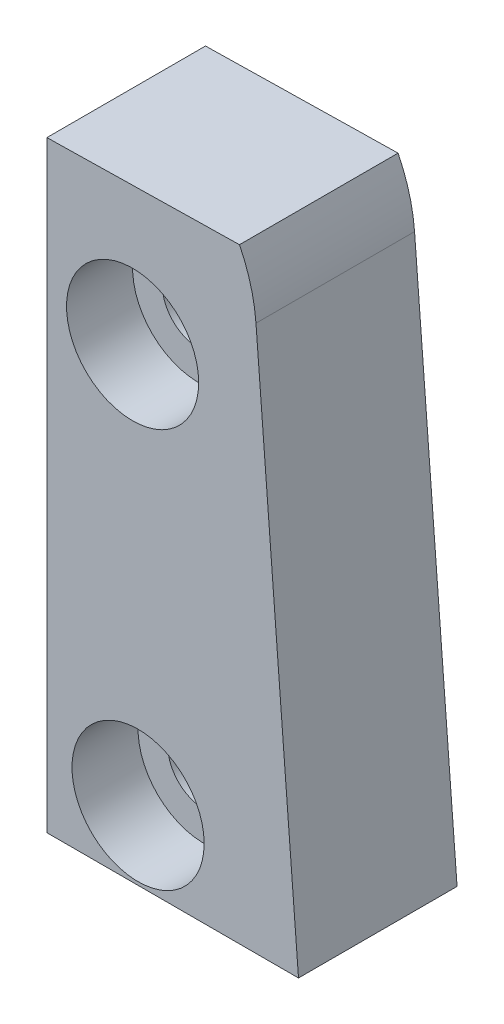
from build123d import *

# Parameters (mm, degrees)
BOSS_EXTRUDE1_DEPTH = 1.8
SKETCH3_R           = 1.1
BOSS_EXTRUDE2_DEPTH = 3
SKETCH4_W           = 2.663520563
SKETCH4_H           = 7.169309516
CUT_EXTRUDE1_DEPTH  = 2
SKETCH5_R           = 2
CUT_EXTRUDE2_DEPTH  = 2


with BuildPart() as part:
    # Sketch1 → Boss-Extrude1 (new body)
    with BuildSketch(Plane(origin=(0, 0, 0), x_dir=(0, 1, 0), z_dir=(0, 0, 1))):
        with BuildLine():
            Line((6.830014349, -2.344806069), (-9.690684049, -3.631823148))
            Line((-9.690684049, -3.631823148), (-9.690684049, -2.205416312))
            Line((-9.690684049, -2.205416312), (6.947514193, -1.975901922))
            Line((6.947514193, -1.975901922), (7.350857331, -1.970338035))
            Line((7.350857331, -1.970338035), (7.269057374, 3.9595904))
            Line((7.269057374, 3.9595904), (8.531793523, 3.982646507))
            Line((8.531793523, 3.982646507), (8.638213972, -1.845785322))
            ThreePointArc((8.638213972, -1.845785322), (7.758081535, -2.182141378), (6.830014349, -2.344806069))
        make_face()
    extrude(amount=BOSS_EXTRUDE1_DEPTH)

    # Sketch3 → Boss-Extrude2 (add)
    with BuildSketch(Plane.XY.offset(1.8)):
        with BuildLine():
            Line((-3.982646507, 8.531793523), (-3.982646507, -9.690684049))
            Line((-3.982646507, -9.690684049), (3.631823148, -9.690684049))
            Line((3.631823148, -9.690684049), (2.344806069, 6.830014349))
            ThreePointArc((2.344806069, 6.830014349), (2.182141378, 7.758081535), (1.845785322, 8.638213972))
            Line((1.845785322, 8.638213972), (-3.982646507, 8.531793523))
        make_face()
        with Locations((-1.223821134, -7.594621825)):
            Circle(SKETCH3_R, mode=Mode.SUBTRACT)
        with Locations((-1.389338495, 4.404236621)):
            Circle(SKETCH3_R, mode=Mode.SUBTRACT)
    extrude(amount=BOSS_EXTRUDE2_DEPTH)

    # Sketch4 → Cut-Extrude1 (cut)
    with BuildSketch(Plane(origin=(0, 0, 1.8), x_dir=(1, 0, 0), z_dir=(0, 0, -1))):
        with Locations((-1.621806935, 1.615257833)):
            Rectangle(SKETCH4_W, SKETCH4_H)
    extrude(amount=-CUT_EXTRUDE1_DEPTH, mode=Mode.SUBTRACT)

    # Sketch5 → Cut-Extrude2 (cut)
    with BuildSketch(Plane.XY.offset(4.8)):
        with Locations((-1.389338495, 4.404236621)):
            Circle(SKETCH5_R)
        with Locations((-1.223821134, -7.594621825)):
            Circle(SKETCH5_R)
    extrude(amount=-CUT_EXTRUDE2_DEPTH, mode=Mode.SUBTRACT)


solid = part.part
